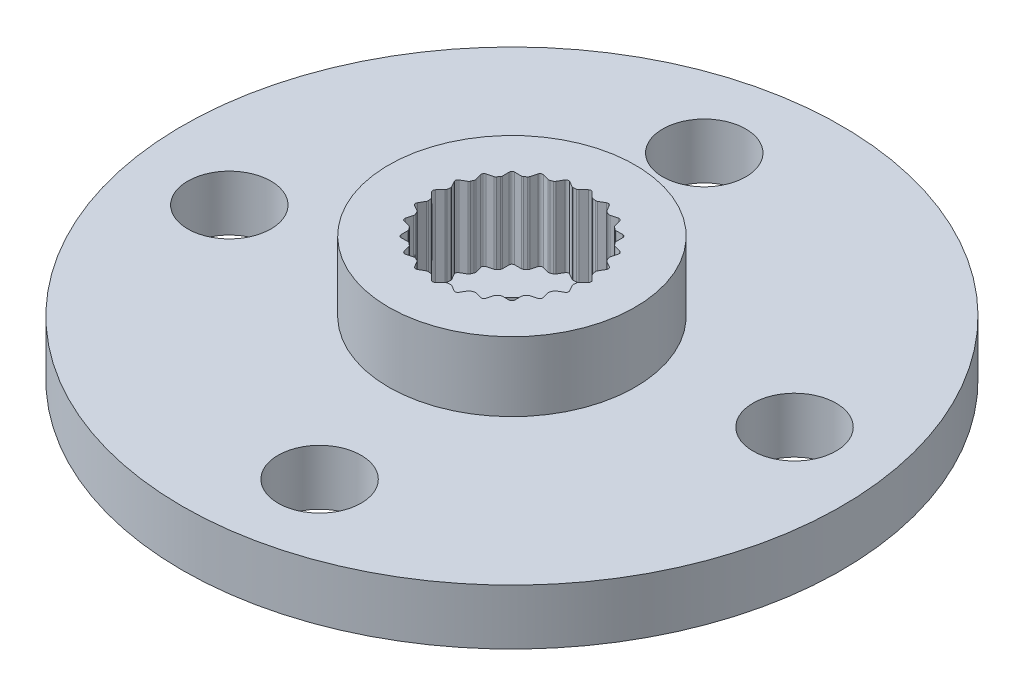
from build123d import *

# Parameters (mm, degrees)
SKETCH_1_R                       = 11.9
EXTRUDE_1_DEPTH                  = 2
SKETCH_2_R                       = 4.45
EXTRUDE_2_DEPTH                  = 2.5
SKETCH_3_R                       = 3.75
EXTRUDE_3_DEPTH                  = 0.5
SKETCH_4_R                       = 3
CUT_EXTRUDE_1_DEPTH              = 1
SKETCH_5_R                       = 1.4
CUT_EXTRUDE_2_DEPTH              = 18.29797676
SKETCH_6_R                       = 2.65
CUT_EXTRUDE_3_DEPTH              = 2.9
CUT_EXTRUDE_4_DEPTH              = 2.9
FILLET_1_R                       = 0.1
PATTERN_CIRCULAR_1_COUNT         = 24
FILLET_1_OF_PATTERN_CIRCULAR_1_R = 0.1
ESQUISSE1_R                      = 1.5
ENL_V_MAT_EXTRU_1_DEPTH          = 10
R_P_TITION_CIRCULAIRE1_COUNT     = 4


with BuildPart() as part:
    # Эскиз1 → Бобышка-Вытянуть1 (new body)
    with BuildSketch(Plane(origin=(0, 0, 0), x_dir=(1, 0, 0), z_dir=(0, 1, 0))):
        with Locations(Location((0, 0, 0), (0, 0, 270))):
            Circle(SKETCH_1_R)
    extrude(amount=EXTRUDE_1_DEPTH)

    # Эскиз2 → Бобышка-Вытянуть2 (add)
    with BuildSketch(Plane(origin=(0, 2, 0), x_dir=(1, 0, 0), z_dir=(0, 1, 0))):
        with Locations(Location((0, 0, 0), (0, 0, 270))):
            Circle(SKETCH_2_R)
    extrude(amount=EXTRUDE_2_DEPTH)

    # Эскиз3 → Бобышка-Вытянуть3 (add)
    with BuildSketch(Plane.XZ):
        with Locations(Location((0, 0, 0), (0, 0, 90))):
            Circle(SKETCH_3_R)
    extrude(amount=EXTRUDE_3_DEPTH)

    # Эскиз4 → Вырез-Вытянуть1 (cut)
    with BuildSketch(Plane.XZ.offset(0.5)):
        with Locations(Location((0, 0, 0), (0, 0, 270))):
            Circle(SKETCH_4_R)
    extrude(amount=-CUT_EXTRUDE_1_DEPTH, mode=Mode.SUBTRACT)

    # Эскиз5 → Вырез-Вытянуть2 (cut, through all)
    with BuildSketch(Plane.XZ.offset(-0.5)):
        with Locations(Location((0, 0, 0), (0, 0, 270))):
            Circle(SKETCH_5_R)
    extrude(amount=-CUT_EXTRUDE_2_DEPTH, mode=Mode.SUBTRACT)

    # Эскиз6 → Вырез-Вытянуть3 (cut)
    with BuildSketch(Plane(origin=(0, 4.5, 0), x_dir=(1, 0, 0), z_dir=(0, 1, 0))):
        with Locations(Location((0, 0, 0), (0, 0, 270))):
            Circle(SKETCH_6_R)
    extrude(amount=-CUT_EXTRUDE_3_DEPTH, mode=Mode.SUBTRACT)

    # Эскиз7 → Вырез-Вытянуть4 (cut)
    with BuildSketch(Plane(origin=(0, 4.5, 0), x_dir=(1, 0, 0), z_dir=(0, 1, 0))):
        with BuildLine():
            Line((0, 2.9), (-0.263092253, 2.636907747))
            ThreePointArc((-0.263092253, 2.636907747), (0, 2.65), (0.263092253, 2.636907747))
            Line((0.263092253, 2.636907747), (0, 2.9))
        make_face()
    cut_extrude_4 = extrude(amount=-CUT_EXTRUDE_4_DEPTH, mode=Mode.SUBTRACT)

    # Скругление1
    fillet_1_edges = [part.edges().sort_by_distance(p)[0] for p in [
        (0, 3.05, -2.9),
        (0.263092253, 3.05, -2.636907747),
        (-0.263092253, 3.05, -2.636907747),
    ]]
    fillet(fillet_1_edges, radius=FILLET_1_R)

    # Круговой массив1: Вырез-Вытянуть4 ×24 about axis
    pattern_circular_1_axis = Axis((0, 0, 0), (0, 1, 0))
    for i in range(1, PATTERN_CIRCULAR_1_COUNT):
        add(cut_extrude_4.rotate(pattern_circular_1_axis, i * 360 / PATTERN_CIRCULAR_1_COUNT), mode=Mode.SUBTRACT)

    # Скругление1 of Круговой массив1
    fillet_1_of_pattern_circular_1_edges = [part.edges().sort_by_distance(p)[0] for p in [
        (-0.750575231, 3.05, -2.801184896),
        (-0.428354343, 3.05, -2.61515058),
        (-0.936609547, 3.05, -2.478964009),
        (-1.45, 3.05, -2.511473671),
        (-1.090609299, 3.05, -2.415175223),
        (-1.546298448, 3.05, -2.15208297),
        (-2.050609665, 3.05, -2.050609665),
        (-1.678541033, 3.05, -2.050609665),
        (-2.050609665, 3.05, -1.678541033),
        (-2.511473671, 3.05, -1.45),
        (-2.15208297, 3.05, -1.546298448),
        (-2.415175223, 3.05, -1.090609299),
        (-2.801184896, 3.05, -0.750575231),
        (-2.478964009, 3.05, -0.936609547),
        (-2.61515058, 3.05, -0.428354343),
        (-2.9, 3.05, 0),
        (-2.636907747, 3.05, -0.263092253),
        (-2.636907747, 3.05, 0.263092253),
        (-2.801184896, 3.05, 0.750575231),
        (-2.61515058, 3.05, 0.428354343),
        (-2.478964009, 3.05, 0.936609547),
        (-2.511473671, 3.05, 1.45),
        (-2.415175223, 3.05, 1.090609299),
        (-2.15208297, 3.05, 1.546298448),
        (-2.050609665, 3.05, 2.050609665),
        (-2.050609665, 3.05, 1.678541033),
        (-1.678541033, 3.05, 2.050609665),
        (-1.45, 3.05, 2.511473671),
        (-1.546298448, 3.05, 2.15208297),
        (-1.090609299, 3.05, 2.415175223),
        (-0.750575231, 3.05, 2.801184896),
        (-0.936609547, 3.05, 2.478964009),
        (-0.428354343, 3.05, 2.61515058),
        (0, 3.05, 2.9),
        (-0.263092253, 3.05, 2.636907747),
        (0.263092253, 3.05, 2.636907747),
        (0.750575231, 3.05, 2.801184896),
        (0.428354343, 3.05, 2.61515058),
        (0.936609547, 3.05, 2.478964009),
        (1.45, 3.05, 2.511473671),
        (1.090609299, 3.05, 2.415175223),
        (1.546298448, 3.05, 2.15208297),
        (2.050609665, 3.05, 2.050609665),
        (1.678541033, 3.05, 2.050609665),
        (2.050609665, 3.05, 1.678541033),
        (2.511473671, 3.05, 1.45),
        (2.15208297, 3.05, 1.546298448),
        (2.415175223, 3.05, 1.090609299),
        (2.801184896, 3.05, 0.750575231),
        (2.478964009, 3.05, 0.936609547),
        (2.61515058, 3.05, 0.428354343),
        (2.9, 3.05, 0),
        (2.636907747, 3.05, 0.263092253),
        (2.636907747, 3.05, -0.263092253),
        (2.801184896, 3.05, -0.750575231),
        (2.61515058, 3.05, -0.428354343),
        (2.478964009, 3.05, -0.936609547),
        (2.511473671, 3.05, -1.45),
        (2.415175223, 3.05, -1.090609299),
        (2.15208297, 3.05, -1.546298448),
        (2.050609665, 3.05, -2.050609665),
        (2.050609665, 3.05, -1.678541033),
        (1.678541033, 3.05, -2.050609665),
        (1.45, 3.05, -2.511473671),
        (1.546298448, 3.05, -2.15208297),
        (1.090609299, 3.05, -2.415175223),
        (0.750575231, 3.05, -2.801184896),
        (0.936609547, 3.05, -2.478964009),
        (0.428354343, 3.05, -2.61515058),
    ]]
    fillet(fillet_1_of_pattern_circular_1_edges, radius=FILLET_1_OF_PATTERN_CIRCULAR_1_R)

    # Esquisse1 → Enlèv. mat.-Extru.1 (cut)
    with BuildSketch(Plane.XZ):
        with Locations(Location((-8.574166059, 1.62959761, 0), (0, 0, 270))):
            Circle(ESQUISSE1_R)
    enl_v_mat_extru_1 = extrude(amount=-ENL_V_MAT_EXTRU_1_DEPTH, mode=Mode.SUBTRACT)

    # Répétition circulaire1: Enlèv. mat.-Extru.1 ×4 about axis
    r_p_tition_circulaire1_axis = Axis((0, 0, 0), (0, 1, 0))
    for i in range(1, R_P_TITION_CIRCULAIRE1_COUNT):
        add(enl_v_mat_extru_1.rotate(r_p_tition_circulaire1_axis, i * 360 / R_P_TITION_CIRCULAIRE1_COUNT), mode=Mode.SUBTRACT)


solid = part.part
